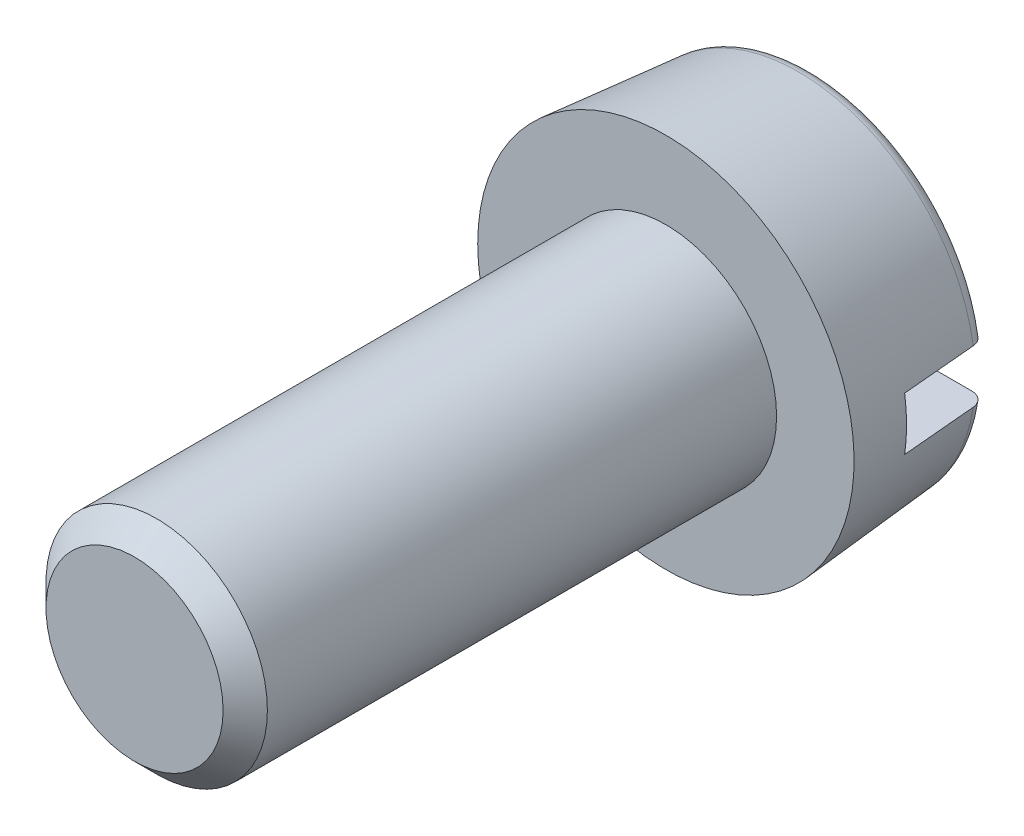
from build123d import *

# Parameters (mm, degrees)
ESQUISSE2_W             = 8.5
ESQUISSE2_H             = 1.2
ENLEV_MAT_EXTRU_1_DEPTH = 2
ESQUISSE3_W             = 2.5
ESQUISSE3_H             = 12
CHANFREIN1_SIZE         = 0.5


with BuildPart() as part:
    # Esquisse1 → Base-Révolution (revolve)
    with BuildSketch(Plane(origin=(0, 0, 0), x_dir=(1, 0, 0), z_dir=(0, 1, 0)), mode=Mode.PRIVATE) as base_r_volution_sk:
        with BuildLine():
            Line((0, 0), (4.25, 0))
            Line((4.25, 0), (3.987642373, 2.998761395))
            ThreePointArc((3.987642373, 2.998761395), (3.881842891, 3.213301521), (3.658898123, 3.3))
            Line((3.658898123, 3.3), (0, 3.3))
            Line((0, 3.3), (0, 0))
        make_face()
    revolve(base_r_volution_sk.sketch.rotate(Axis((0, 0, 0), (0, 0, -1)), 180), axis=Axis((0, 0, 0), (0, 0, -1)))

    # Esquisse2 → Enlev. mat.-Extru.1 (cut)
    with BuildSketch(Plane.XY.offset(-3.3)):
        Rectangle(ESQUISSE2_W, ESQUISSE2_H)
    extrude(amount=ENLEV_MAT_EXTRU_1_DEPTH, mode=Mode.SUBTRACT)

    # Esquisse3 → Boss.-Révol.1 (revolve)
    with BuildSketch(Plane(origin=(0, 0, 0), x_dir=(1, 0, 0), z_dir=(0, 1, 0)), mode=Mode.PRIVATE) as boss_r_vol_1_sk:
        with Locations((1.25, -6)):
            Rectangle(ESQUISSE3_W, ESQUISSE3_H)
    revolve(boss_r_vol_1_sk.sketch.rotate(Axis((0, 0, 0), (0, 0, 1)), 351.659338237), axis=Axis((0, 0, 0), (0, 0, 1)))

    # Chanfrein1
    chanfrein1_edges = [part.edges().sort_by_distance(p)[0] for p in [
        (-2.473557732, 0.362646032, 12),
    ]]
    chamfer(chanfrein1_edges, length=CHANFREIN1_SIZE)


solid = part.part
